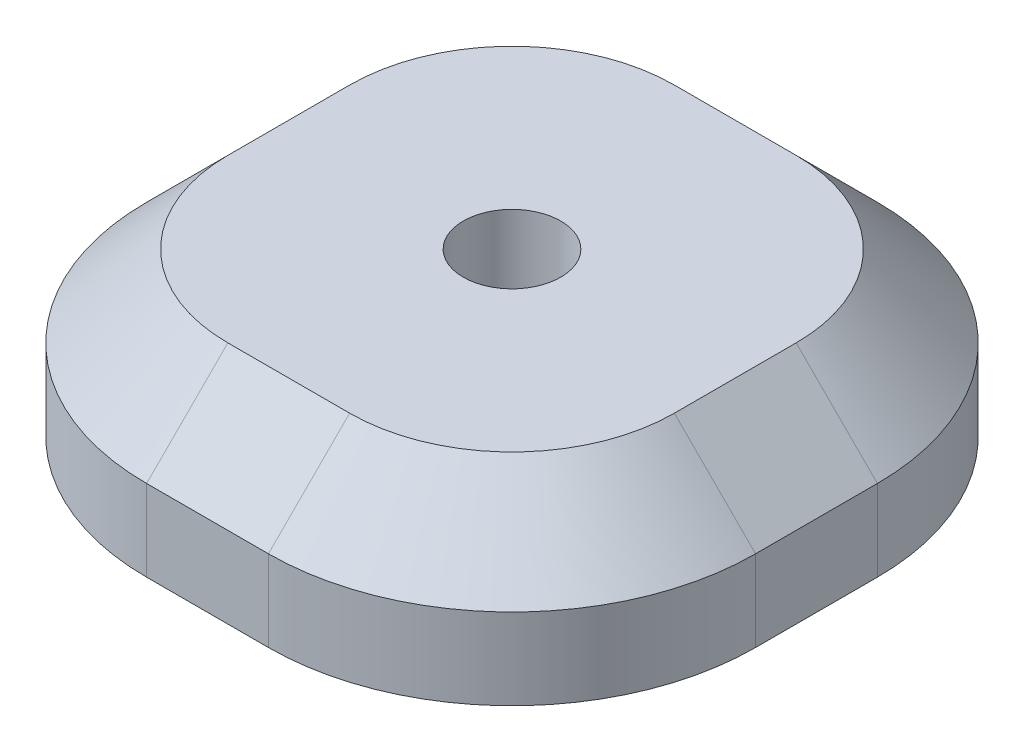
from build123d import *

# Parameters (mm, degrees)
SKETCH_1_W          = 75
SKETCH_1_H          = 75
EXTRUDE_1_DEPTH     = 20
FILLET_1_R          = 30
CHAMFER_1_SIZE      = 10
HOLE_WIZARD_1_D     = 12
HOLE_WIZARD_1_DEPTH = 10
HOLE_WIZARD_1_TIP   = 3.605163714
HOLE_WIZARD_2_D     = 12
HOLE_WIZARD_2_DEPTH = 10
HOLE_WIZARD_2_TIP   = 3.605163714


with BuildPart() as part:
    # 草圖1 → 擠出1 (new body)
    with BuildSketch(Plane(origin=(0, 0, 0), x_dir=(-1, 0, 0), z_dir=(0, 1, 0))):
        Rectangle(SKETCH_1_W, SKETCH_1_H)
    extrude(amount=EXTRUDE_1_DEPTH)

    # 圓角1
    fillet_1_edges = [part.edges().sort_by_distance(p)[0] for p in [
        (-37.5, 10, -37.5),
        (37.5, 10, -37.5),
        (37.5, 10, 37.5),
        (-37.5, 10, 37.5),
    ]]
    fillet(fillet_1_edges, radius=FILLET_1_R)

    # 倒角1
    chamfer_1_edges = [part.edges().sort_by_distance(p)[0] for p in [
        (0, 20, -37.5),
        (37.5, 20, 0),
        (-37.5, 20, 0),
        (0, 20, 37.5),
        (28.713203436, 20, 28.713203436),
        (-28.713203436, 20, -28.713203436),
        (-28.713203436, 20, 28.713203436),
        (28.713203436, 20, -28.713203436),
    ]]
    chamfer(chamfer_1_edges, length=CHAMFER_1_SIZE)

    # 孔1
    with Locations(Plane(origin=(0, 0, 0), x_dir=(-1, 0, 0), z_dir=(0, -1, 0))):
        with Locations((12.5, -12.5), (-12.5, -12.5), (-12.5, 12.5), (12.5, 12.5)):
            Hole(HOLE_WIZARD_1_D / 2, depth=HOLE_WIZARD_1_DEPTH)
            with Locations((0, 0, -(HOLE_WIZARD_1_DEPTH + HOLE_WIZARD_1_TIP / 2))):  # 118° drill point
                Cone(0, HOLE_WIZARD_1_D / 2, HOLE_WIZARD_1_TIP, mode=Mode.SUBTRACT)

    # 孔2
    with Locations(Plane(origin=(0, 20, 0), x_dir=(1, 0, 0), z_dir=(0, 1, 0))):
        with Locations((0, 0)):
            Hole(HOLE_WIZARD_2_D / 2, depth=HOLE_WIZARD_2_DEPTH)
            with Locations((0, 0, -(HOLE_WIZARD_2_DEPTH + HOLE_WIZARD_2_TIP / 2))):  # 118° drill point
                Cone(0, HOLE_WIZARD_2_D / 2, HOLE_WIZARD_2_TIP, mode=Mode.SUBTRACT)


solid = part.part
